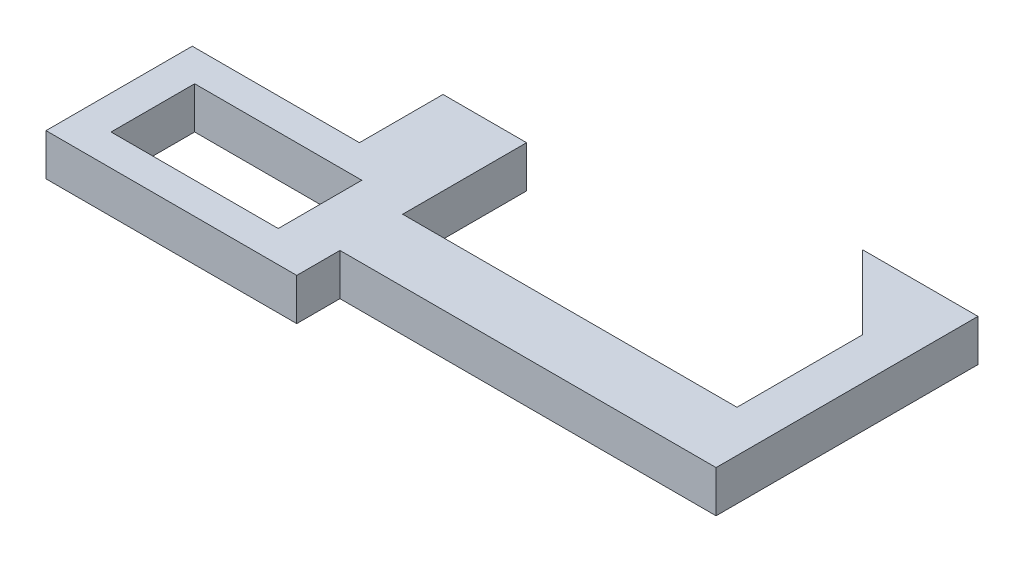
from build123d import *

# Parameters (mm, degrees)
BOSS_EXTRUDE1_DEPTH = 0.5


with BuildPart() as part:
    # Sketch1 → Boss-Extrude1 (new body)
    with BuildSketch(Plane(origin=(0, 0, 0), x_dir=(1, 0, 0), z_dir=(0, 1, 0))):
        Polygon((-23.973296771, 22.315949047), (-27.973296771, 22.315949047), (-27.973296771, 23.798880368), (-28.973178979, 23.798880368), (-28.973178979, 22.798880368), (-30.973296771, 22.798880368), (-30.973296771, 21.923880368), (-30.973296771, 21.048880368), (-27.973296771, 21.048880368), (-27.973296771, 21.565949047), (-23.473296771, 21.565949047), (-23.473296771, 24.699832523), (-24.857180247, 24.699832523), (-23.973296771, 23.815949047), align=None)
        Polygon((-30.569749298, 21.423880368), (-30.569749298, 21.923880368), (-30.569749298, 22.423880368), (-28.569749298, 22.423880368), (-28.569749298, 21.423880368), align=None, mode=Mode.SUBTRACT)
    extrude(amount=BOSS_EXTRUDE1_DEPTH)


solid = part.part
